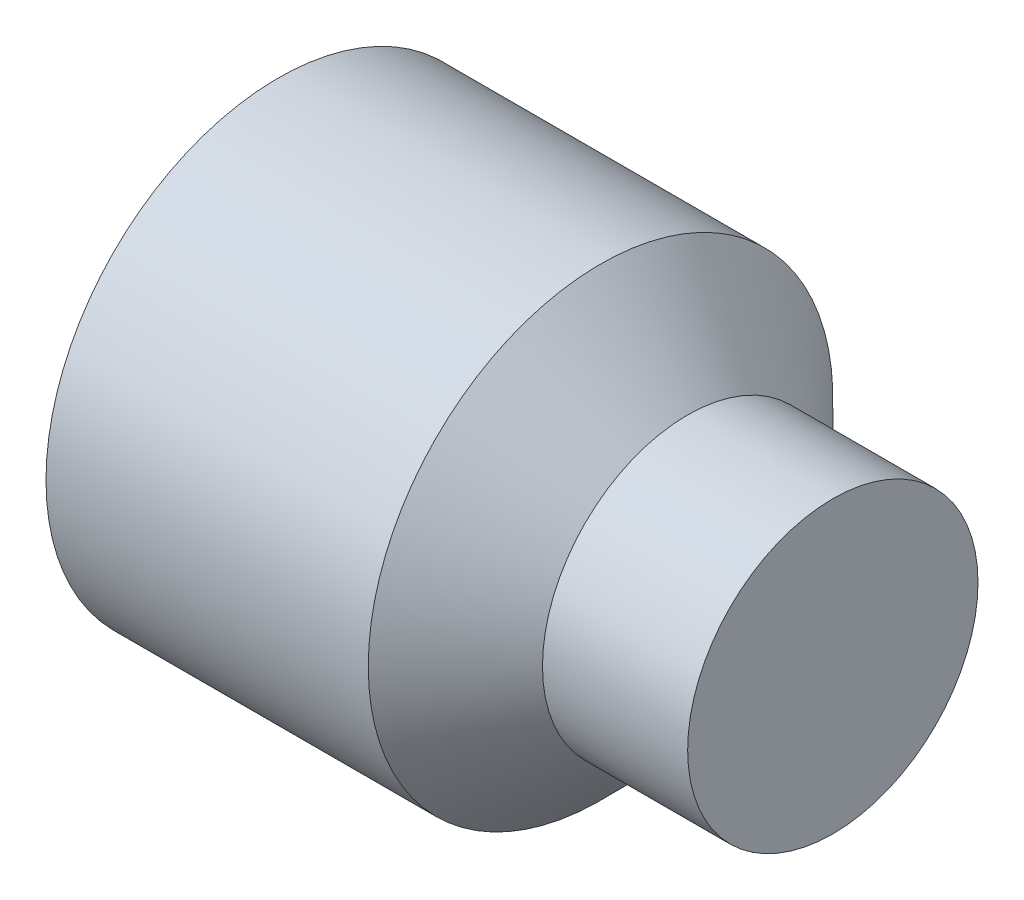
from build123d import *

# Parameters (mm, degrees)
HEX_2_DEPTH = 1.5


with BuildPart() as part:
    # BodySke → BaseBody (revolve)
    with BuildSketch(Plane.XY, mode=Mode.PRIVATE) as basebody_sk:
        Polygon((0, 0), (0, 1.61), (0.225166605, 2), (3, 2), (3.75, 1.25), (5, 1.25), (5, 0), align=None)
    revolve(basebody_sk.sketch.rotate(Axis((-12.7, 0, 0), (1, 0, 0)), 90), axis=Axis((-12.7, 0, 0), (1, 0, 0)))

    # Sketch2 → Hex 2 (cut)
    with BuildSketch(Plane.ZY):
        Polygon((0.577350269, 1), (-0.577350269, 1), (-1.154700538, 0), (-0.577350269, -1), (0.577350269, -1), (1.154700538, 0), align=None)
    extrude(amount=-HEX_2_DEPTH, mode=Mode.SUBTRACT)


solid = part.part
